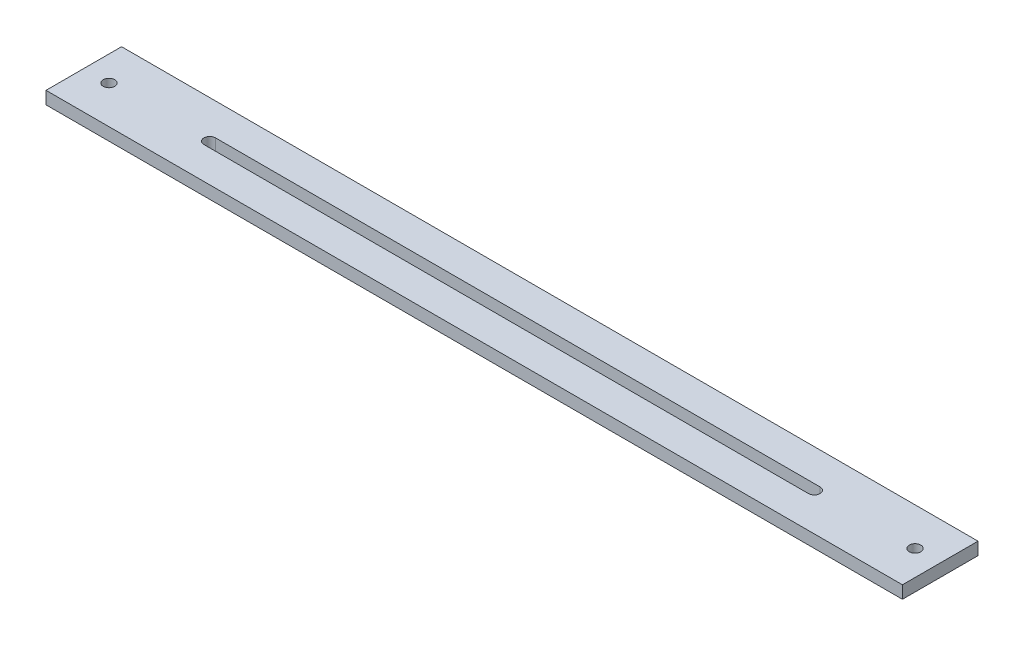
from build123d import *

# Parameters (mm, degrees)
SKETCH1_W           = 215.9
SKETCH1_H           = 19.05
BOSS_EXTRUDE1_DEPTH = 3.175
SKETCH3_R           = 1.4605
CUT_EXTRUDE5_DEPTH  = 217.762065696


with BuildPart() as part:
    # Sketch1 → Boss-Extrude1 (new body)
    with BuildSketch(Plane(origin=(0, 0, 0), x_dir=(1, 0, 0), z_dir=(0, 1, 0))):
        with Locations((107.95, 9.525)):
            Rectangle(SKETCH1_W, SKETCH1_H)
    extrude(amount=BOSS_EXTRUDE1_DEPTH)

    # Sketch3 → Cut-Extrude5 (cut, through all)
    with BuildSketch(Plane(origin=(0, 3.175, 0), x_dir=(1, 0, 0), z_dir=(0, 1, 0))):
        with BuildLine():
            Line((184.15, 10.9855), (31.75, 10.9855))
            ThreePointArc((31.75, 10.9855), (30.2895, 9.525), (31.75, 8.0645))
            Line((31.75, 8.0645), (184.15, 8.0645))
            ThreePointArc((184.15, 8.0645), (185.6105, 9.525), (184.15, 10.9855))
        make_face()
        with Locations(Location((6.35, 9.525, 0), (0, 0, 270))):
            Circle(SKETCH3_R)
        with Locations(Location((209.55, 9.525, 0), (0, 0, 270))):
            Circle(SKETCH3_R)
    extrude(amount=-CUT_EXTRUDE5_DEPTH, mode=Mode.SUBTRACT)


solid = part.part
